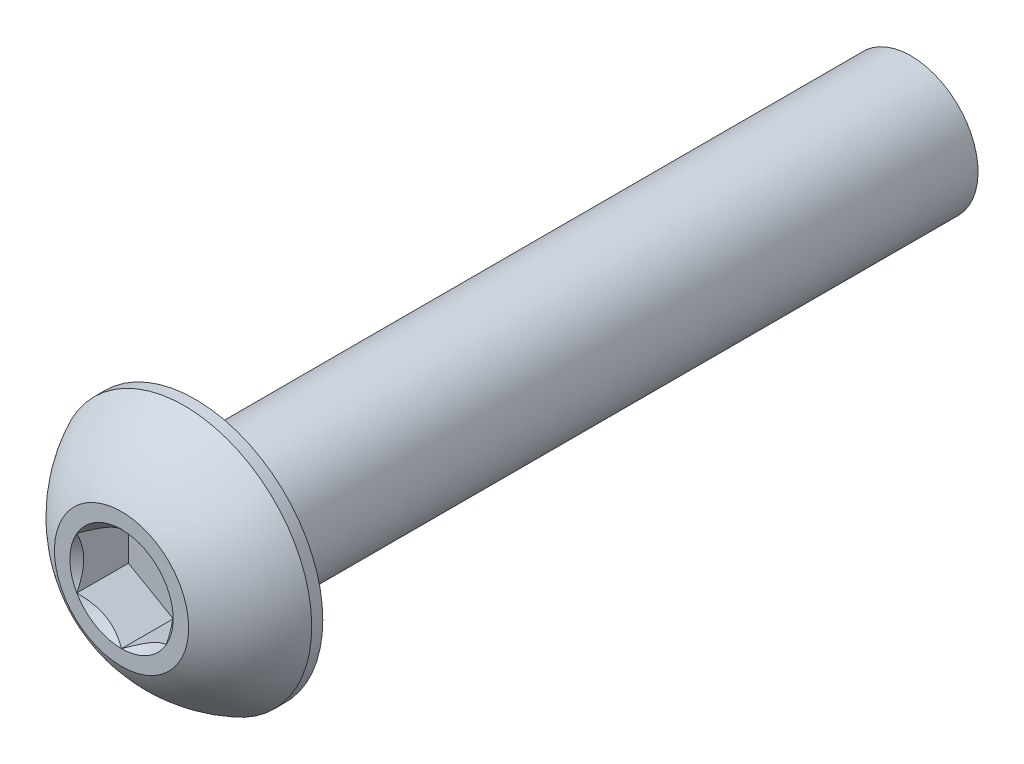
from build123d import *

# Parameters (mm, degrees)
SKETCH1_W              = 16
SKETCH1_H              = 1.5
CUT_EXTRUDE2_DEPTH     = 1.155
SPLIT1_SURFACE_1_BACK  = 20.404
SPLIT1_SURFACE_1_DEPTH = 40.808
SPLIT1_SURFACE_2_BACK  = 20.404
SPLIT1_SURFACE_2_DEPTH = 40.808


with BuildPart() as part:
    # Sketch1 → Revolve1 (revolve)
    with BuildSketch(Plane(origin=(0, 0, 0), x_dir=(0, 0, -1), z_dir=(1, 0, 0))):
        with Locations((9.65, 0.75)):
            Rectangle(SKETCH1_W, SKETCH1_H)
    revolve(axis=Axis((0, 0, -17.65), (0, 0, 1)))

    # Sketch7 → Revolve2 (revolve)
    with BuildSketch(Plane(origin=(0, 0, 0), x_dir=(0, 0, -1), z_dir=(1, 0, 0))):
        with BuildLine():
            Line((1.4025, 2.85), (1.65, 2.85))
            Line((1.65, 2.85), (1.65, 0))
            Line((1.65, 0), (0, 0))
            Line((0, 0), (0, 1.5))
            ThreePointArc((0, 1.5), (0.59512511, 2.285251969), (1.4025, 2.85))
        make_face()
    revolve(axis=Axis((0, 0, 0), (0, 0, -1)))

    # Sketch5 → Cut-Extrude2 (cut)
    with BuildSketch(Plane.XY):
        Polygon((1, -0.577350269), (1, 0.577350269), (0, 1.154700538), (-1, 0.577350269), (-1, -0.577350269), (0, -1.154700538), align=None)
    extrude(amount=-CUT_EXTRUDE2_DEPTH, mode=Mode.SUBTRACT)

    # Cut-Extrude3 cone 1 section (through the dimple's axis) → Cut-Extrude3 (revolve, cut)
    with BuildSketch(Plane(origin=(0, 0, 0), x_dir=(0, -1, 0), z_dir=(1, 0, 0))):
        Polygon((0, 0), (1.154700538, 0), (0, 1.154700538), align=None)
    revolve(axis=Axis((0, 0, 0), (0, 0, -1)), mode=Mode.SUBTRACT)


with BuildPart() as body_2:
    # Split1: the piece behind the surface
    add(part.part)
    # Split1 surface: a surface, the sketch's curves swept straight by 40.808 mm
    with BuildLine(Plane(origin=(0, 0, 0), x_dir=(0, 0, -1), z_dir=(1, 0, 0)).offset(-SPLIT1_SURFACE_1_BACK), mode=Mode.PRIVATE) as split1_surface_1_path:
        Line((1.65, -2.85), (1.65, 2.85))
    split1_surface_1 = Shell.extrude(split1_surface_1_path.wire(), (1 * SPLIT1_SURFACE_1_DEPTH, 0 * SPLIT1_SURFACE_1_DEPTH, 0 * SPLIT1_SURFACE_1_DEPTH))
    split(bisect_by=split1_surface_1, keep=Keep.BOTTOM)


with BuildPart() as part_1:
    add(part.part)

    # Split1: split by a surface, the side it looks to stays
    # Split1 surface: a surface, the sketch's curves swept straight by 40.808 mm
    with BuildLine(Plane(origin=(0, 0, 0), x_dir=(0, 0, -1), z_dir=(1, 0, 0)).offset(-SPLIT1_SURFACE_2_BACK), mode=Mode.PRIVATE) as split1_surface_2_path:
        Line((1.65, -2.85), (1.65, 2.85))
    split1_surface_2 = Shell.extrude(split1_surface_2_path.wire(), (1 * SPLIT1_SURFACE_2_DEPTH, 0 * SPLIT1_SURFACE_2_DEPTH, 0 * SPLIT1_SURFACE_2_DEPTH))
    split(bisect_by=split1_surface_2, keep=Keep.TOP)


solid = Compound([body_2.part, part_1.part])
